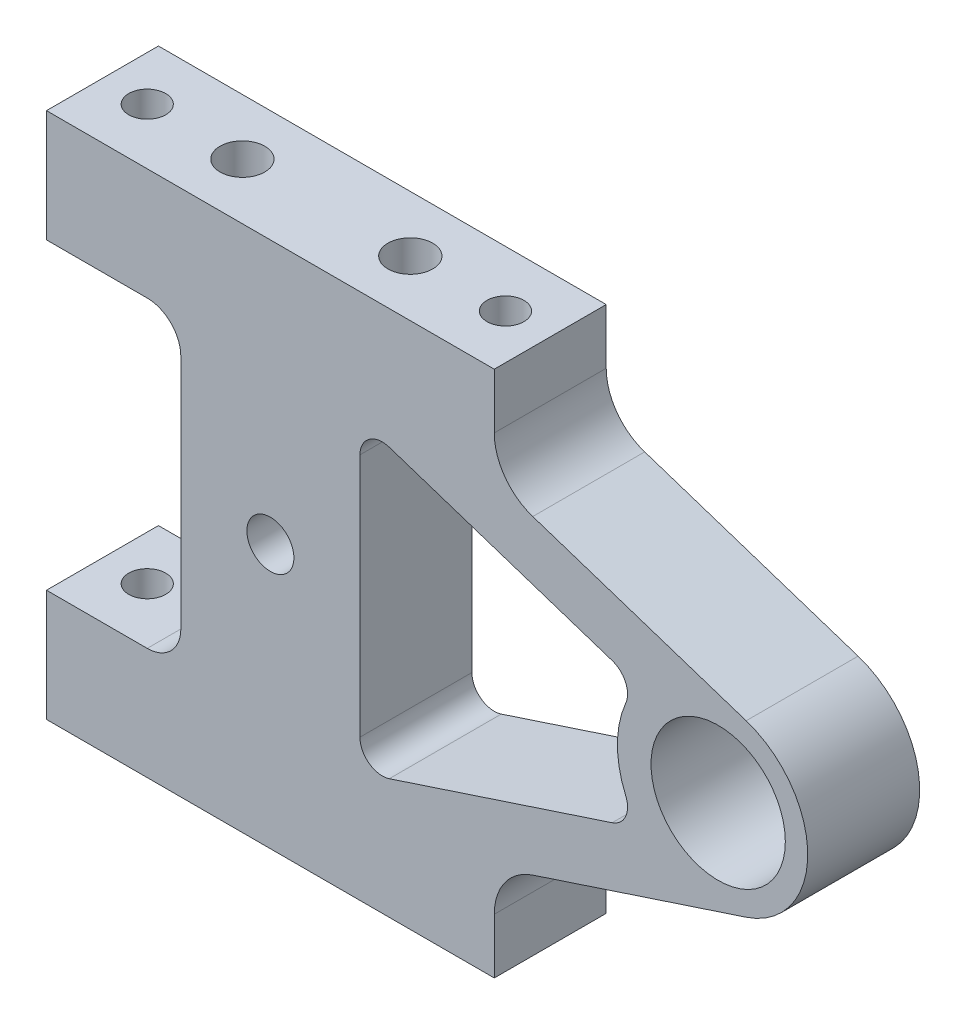
from build123d import *

# Parameters (mm, degrees)
SKETCH_1_W                  = 40
SKETCH_1_H                  = 47.1
EXTRUDE_1_DEPTH             = 5
HOLE_WIZARD_M4_1_AT_2_COUNT = 2
HOLE_WIZARD_M4_1_AT_2_PITCH = 32
SKETCH_5_R                  = 2.1
CUT_EXTRUDE_M5_DEPTH        = 25
SKETCH_6_R                  = 6
EXTRUDE_1739_DEPTH          = 10
FILLET_1_R                  = 5
SKETCH_7_W                  = 24
SKETCH_7_H                  = 27.1
CUT_EXTRUDE_1_DEPTH         = 10
FILLET_2_R                  = 3
F_4_0MM_1_AT_2_COUNT        = 2
F_4_0MM_1_AT_2_PITCH        = 15
CUT_EXTRUDE_3_DEPTH         = 10
FILLET_3_R                  = 2


with BuildPart() as part:
    # 草图1 → 凸台-拉伸1 (new, symmetric)
    with BuildSketch(Plane.XY):
        Rectangle(SKETCH_1_W, SKETCH_1_H)
    extrude(amount=EXTRUDE_1_DEPTH, both=True)

    # 草图4 → M4 螺纹孔1 (revolve, cut)
    with BuildSketch(Plane(origin=(-16, 23.55, 0), x_dir=(0, 0, 1), z_dir=(1, 0, 0))):
        Polygon((0, 0), (0, 11.091420021), (1.65, 10.1), (1.65, 0), align=None)
    hole_wizard_m4_1 = revolve(axis=Axis((-16, 29.9, 0), (0, -1, 0)), mode=Mode.SUBTRACT)

    # M4 螺纹孔1 at 2: M4 螺纹孔1 ×2
    with Locations(*[(i * HOLE_WIZARD_M4_1_AT_2_PITCH, 0, 0) for i in range(1, HOLE_WIZARD_M4_1_AT_2_COUNT)]):
        add(hole_wizard_m4_1, mode=Mode.SUBTRACT)

    # 镜向1: M4 螺纹孔1 across plane
    add(hole_wizard_m4_1.mirror(Plane.ZX), mode=Mode.SUBTRACT)

    # 镜向1 copy 1 sketch → 镜向1 copy 1 (revolve, cut)
    with BuildSketch(Plane(origin=(16, -23.55, 0), x_dir=(0, 0, 1), z_dir=(1, 0, 0))):
        Polygon((0, 0), (0, -11.091420021), (1.65, -10.1), (1.65, 0), align=None)
    revolve(axis=Axis((16, -29.9, 0), (0, -1, 0)), mode=Mode.SUBTRACT)

    # 草图5 → M5螺纹孔 (cut, symmetric)
    with BuildSketch(Plane.XY.offset(5)):
        with Locations(Location((0, 0, 0), (0, 0, 180))):
            Circle(SKETCH_5_R)
    extrude(amount=CUT_EXTRUDE_M5_DEPTH, both=True, mode=Mode.SUBTRACT)

    # 草图6 → Extrude 1739 (add)
    with BuildSketch(Plane.XY.offset(5)):
        with BuildLine():
            Line((42.499604204, 7.599472273), (20, 15))
            Line((20, 15), (20, -15))
            Line((20, -15), (42.499604204, -7.599472273))
            ThreePointArc((42.499604204, -7.599472273), (48, 0), (42.499604204, 7.599472273))
        make_face()
        with Locations((40, 0)):
            Circle(SKETCH_6_R, mode=Mode.SUBTRACT)
    extrude(amount=-EXTRUDE_1739_DEPTH)

    # 圆角1
    fillet_1_edges = [part.edges().sort_by_distance(p)[0] for p in [
        (20, -15, 0),
        (20, 15, 0),
    ]]
    fillet(fillet_1_edges, radius=FILLET_1_R)

    # 草图7 → 切除-拉伸1 (cut)
    with BuildSketch(Plane.XY.offset(5)):
        with Locations((-20, 0)):
            Rectangle(SKETCH_7_W, SKETCH_7_H)
    extrude(amount=-CUT_EXTRUDE_1_DEPTH, mode=Mode.SUBTRACT)

    # 圆角2
    fillet_2_edges = [part.edges().sort_by_distance(p)[0] for p in [
        (-8, -13.55, 0),
        (-8, 13.55, 0),
    ]]
    fillet(fillet_2_edges, radius=FILLET_2_R)

    # 草图11 → Ø4.0mm 暗销孔1 (revolve, cut)
    with BuildSketch(Plane(origin=(-7.5, 23.55, 0), x_dir=(0, 0, 1), z_dir=(1, 0, 0))):
        Polygon((0, 0), (0, 6.201721238), (2, 5), (2, 0), align=None)
    f_4_0mm_1 = revolve(axis=Axis((-7.5, 29.9, 0), (0, -1, 0)), mode=Mode.SUBTRACT)

    # Ø4.0mm 暗销孔1 at 2: Ø4.0mm 暗销孔1 ×2
    with Locations(*[(i * F_4_0MM_1_AT_2_PITCH, 0, 0) for i in range(1, F_4_0MM_1_AT_2_COUNT)]):
        add(f_4_0mm_1, mode=Mode.SUBTRACT)

    # 镜向3: Ø4.0mm 暗销孔1 across plane
    add(f_4_0mm_1.mirror(Plane.ZX), mode=Mode.SUBTRACT)

    # 镜向3 copy 1 sketch → 镜向3 copy 1 (revolve, cut)
    with BuildSketch(Plane(origin=(7.5, -23.55, 0), x_dir=(0, 0, 1), z_dir=(1, 0, 0))):
        Polygon((0, 0), (0, -6.201721238), (2, -5), (2, 0), align=None)
    revolve(axis=Axis((7.5, -29.9, 0), (0, -1, 0)), mode=Mode.SUBTRACT)

    # 草图12 → 切除-拉伸3 (cut)
    with BuildSketch(Plane.XY.offset(5)):
        with BuildLine():
            Line((8, 13.683494171), (8, -13.683494171))
            Line((8, -13.683494171), (32.876894011, -5.501032727))
            ThreePointArc((32.876894011, -5.501032727), (31, 0), (32.876894011, 5.501032727))
            Line((32.876894011, 5.501032727), (8, 13.683494171))
        make_face()
    extrude(amount=-CUT_EXTRUDE_3_DEPTH, mode=Mode.SUBTRACT)

    # 圆角3
    fillet_3_edges = [part.edges().sort_by_distance(p)[0] for p in [
        (8, 13.683494171, 0),
        (32.876894011, 5.501032727, 0),
        (32.876894011, -5.501032727, 0),
        (8, -13.683494171, 0),
    ]]
    fillet(fillet_3_edges, radius=FILLET_3_R)


solid = part.part
